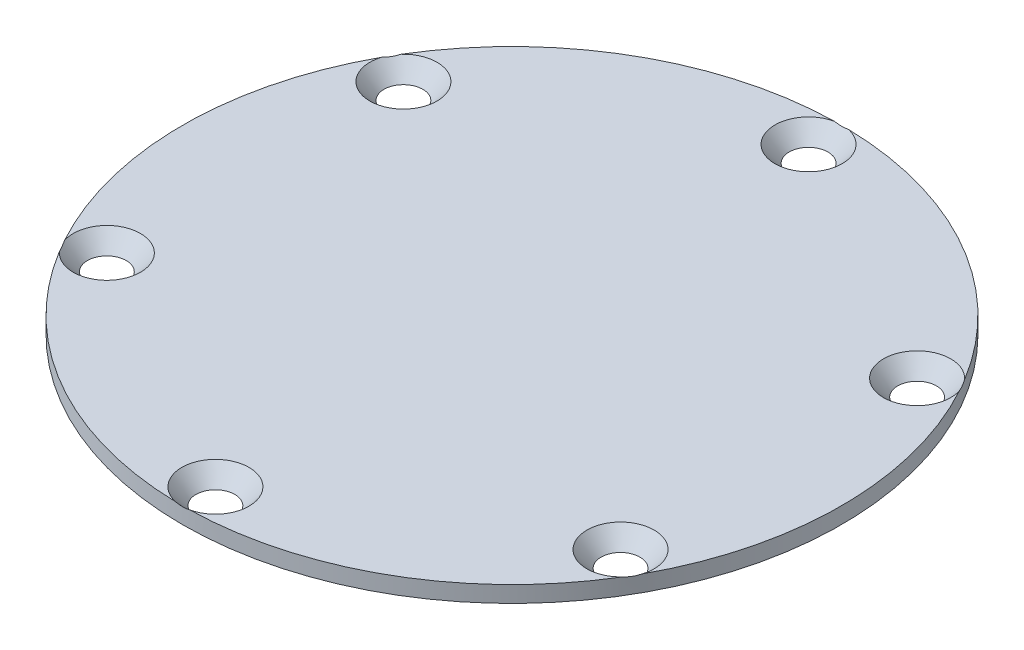
from build123d import *

# Parameters (mm, degrees)
SKETCH1_R                                     = 31.75
BOSS_EXTRUDE1_DEPTH                           = 1.5748
CSK_FOR_4_FLAT_HEAD_SOCKET_CAP_SCREW1_A_COUNT = 2
CSK_FOR_4_FLAT_HEAD_SOCKET_CAP_SCREW1_A_PITCH = 28.575
CSK_FOR_4_FLAT_HEAD_SOCKET_CAP_SCRE_2_COUNT   = 2
CSK_FOR_4_FLAT_HEAD_SOCKET_CAP_SCRE_2_PITCH   = 49.493351826
CSK_FOR_4_FLAT_HEAD_SOCKET_CAP_SCRE_3_COUNT   = 2
CSK_FOR_4_FLAT_HEAD_SOCKET_CAP_SCRE_3_PITCH   = 57.15
CSK_FOR_4_FLAT_HEAD_SOCKET_CAP_SCRE_4_COUNT   = 2
CSK_FOR_4_FLAT_HEAD_SOCKET_CAP_SCRE_4_PITCH   = 49.493351826
CSK_FOR_4_FLAT_HEAD_SOCKET_CAP_SCRE_5_COUNT   = 2
CSK_FOR_4_FLAT_HEAD_SOCKET_CAP_SCRE_5_PITCH   = 28.575


with BuildPart() as part:
    # Sketch1 → Boss-Extrude1 (new body)
    with BuildSketch(Plane(origin=(0, 0, 0), x_dir=(1, 0, 0), z_dir=(0, 1, 0))):
        with Locations(Location((0, 0, 0), (0, 0, 270))):
            Circle(SKETCH1_R)
    extrude(amount=BOSS_EXTRUDE1_DEPTH)

    # Sketch2 → CSK for #4 Flat Head Socket Cap Screw1 (revolve, cut)
    with BuildSketch(Plane(origin=(0, 1.5748, 28.575), x_dir=(0, 0, 1), z_dir=(1, 0, 0))):
        Polygon((0, 0), (0, 1.5748), (1.63195, 1.5748), (1.63195, 1.848124365), (3.2385, 0), align=None)
    csk_for_4_flat_head_socket_cap_screw1 = revolve(axis=Axis((0, 7.9248, 28.575), (0, -1, 0)), mode=Mode.SUBTRACT)

    # CSK for #4 Flat Head Socket Cap Screw1 a: CSK for #4 Flat Head Socket Cap Screw1 ×2
    with Locations(*[Vector(-0.8660254037844382, 0, -0.5000000000000009) * (i * CSK_FOR_4_FLAT_HEAD_SOCKET_CAP_SCREW1_A_PITCH) for i in range(1, CSK_FOR_4_FLAT_HEAD_SOCKET_CAP_SCREW1_A_COUNT)]):
        add(csk_for_4_flat_head_socket_cap_screw1, mode=Mode.SUBTRACT)

    # CSK for _4 Flat Head Socket Cap Scre 2: CSK for #4 Flat Head Socket Cap Screw1 ×2
    with Locations(*[Vector(-0.5000000000000123, 0, -0.8660254037844316) * (i * CSK_FOR_4_FLAT_HEAD_SOCKET_CAP_SCRE_2_PITCH) for i in range(1, CSK_FOR_4_FLAT_HEAD_SOCKET_CAP_SCRE_2_COUNT)]):
        add(csk_for_4_flat_head_socket_cap_screw1, mode=Mode.SUBTRACT)

    # CSK for _4 Flat Head Socket Cap Scre 3: CSK for #4 Flat Head Socket Cap Screw1 ×2
    with Locations(*[(0, 0, -i * CSK_FOR_4_FLAT_HEAD_SOCKET_CAP_SCRE_3_PITCH) for i in range(1, CSK_FOR_4_FLAT_HEAD_SOCKET_CAP_SCRE_3_COUNT)]):
        add(csk_for_4_flat_head_socket_cap_screw1, mode=Mode.SUBTRACT)

    # CSK for _4 Flat Head Socket Cap Scre 4: CSK for #4 Flat Head Socket Cap Screw1 ×2
    with Locations(*[Vector(0.4999999999999877, 0, -0.8660254037844458) * (i * CSK_FOR_4_FLAT_HEAD_SOCKET_CAP_SCRE_4_PITCH) for i in range(1, CSK_FOR_4_FLAT_HEAD_SOCKET_CAP_SCRE_4_COUNT)]):
        add(csk_for_4_flat_head_socket_cap_screw1, mode=Mode.SUBTRACT)

    # CSK for _4 Flat Head Socket Cap Scre 5: CSK for #4 Flat Head Socket Cap Screw1 ×2
    with Locations(*[Vector(0.8660254037844416, 0, -0.499999999999995) * (i * CSK_FOR_4_FLAT_HEAD_SOCKET_CAP_SCRE_5_PITCH) for i in range(1, CSK_FOR_4_FLAT_HEAD_SOCKET_CAP_SCRE_5_COUNT)]):
        add(csk_for_4_flat_head_socket_cap_screw1, mode=Mode.SUBTRACT)


solid = part.part
